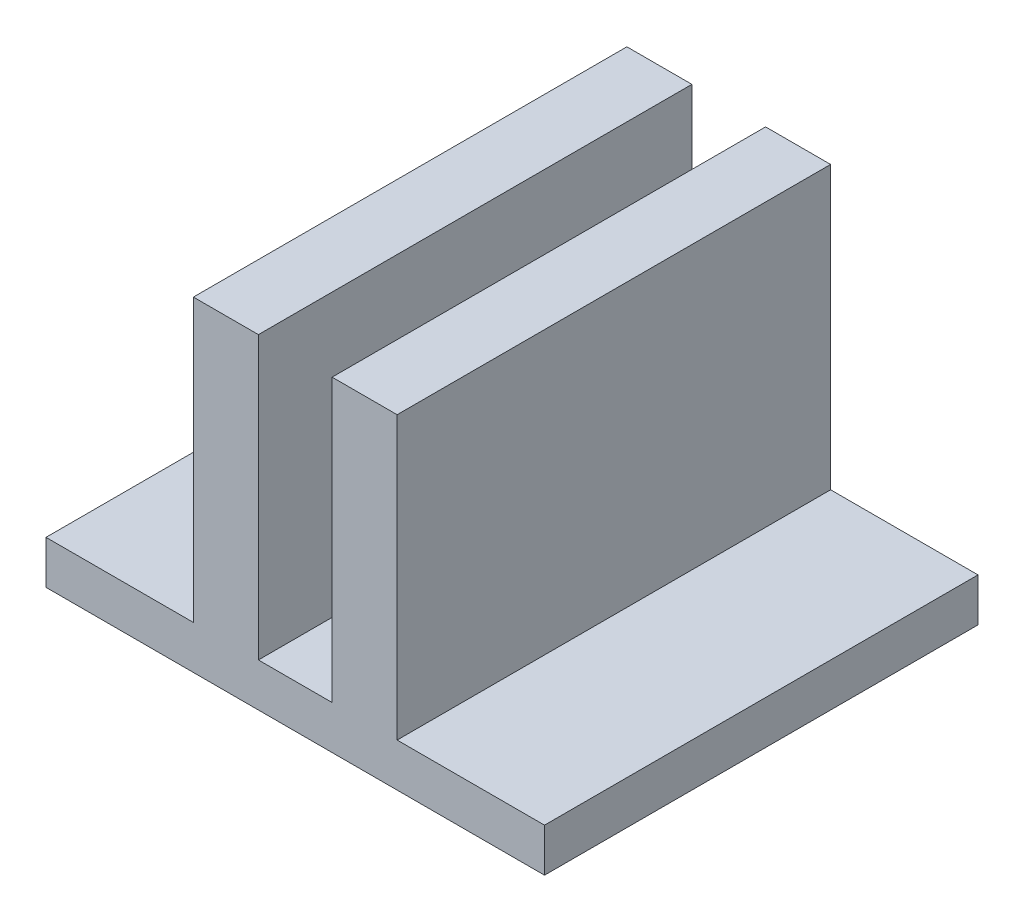
from build123d import *

# Parameters (mm, degrees)
ESQUISSE1_W             = 13
ESQUISSE1_H             = 20
BOSS_EXTRU_1_DEPTH      = 15
ESQUISSE2_W             = 2
ESQUISSE2_H             = 20
ESQUISSE2_W_2           = 3
ENL_V_MAT_EXTRU_2_DEPTH = 13
ESQUISSE4_W             = 20
ESQUISSE4_H             = 2
BOSS_EXTRU_2_DEPTH      = 5
ESQUISSE5_W             = 20
ESQUISSE5_H             = 2
BOSS_EXTRU_3_DEPTH      = 5
ESQUISSE6_W             = 20
ESQUISSE6_H             = 13
ENL_V_MAT_EXTRU_3_DEPTH = 0.2
ESQUISSE7_W             = 20
ESQUISSE7_H             = 13
ENL_V_MAT_EXTRU_4_DEPTH = 0.2
ESQUISSE8_W             = 20
ESQUISSE8_H             = 13
BOSS_EXTRU_4_DEPTH      = 0.2
ESQUISSE9_W             = 20
ESQUISSE9_H             = 13
BOSS_EXTRU_5_DEPTH      = 0.2


with BuildPart() as part:
    # Esquisse1 → Boss.-Extru.1 (new body)
    with BuildSketch(Plane(origin=(0, 0, 0), x_dir=(1, 0, 0), z_dir=(0, 1, 0))):
        with Locations((-1.892857143, 1.160714286)):
            Rectangle(ESQUISSE1_W, ESQUISSE1_H)
    extrude(amount=BOSS_EXTRU_1_DEPTH)

    # Esquisse2 → Enlèv. mat.-Extru.2 (cut)
    with BuildSketch(Plane(origin=(0, 15, 0), x_dir=(1, 0, 0), z_dir=(0, 1, 0))):
        with Locations((-7.392857143, 1.160714286)):
            Rectangle(ESQUISSE2_W, ESQUISSE2_H)
        with Locations((-1.892857143, 1.160714286)):
            Rectangle(ESQUISSE2_W_2, ESQUISSE2_H)
        with Locations((3.607142857, 1.160714286)):
            Rectangle(ESQUISSE2_W, ESQUISSE2_H)
    extrude(amount=-ENL_V_MAT_EXTRU_2_DEPTH, mode=Mode.SUBTRACT)

    # Esquisse4 → Boss.-Extru.2 (add)
    with BuildSketch(Plane.ZY.offset(8.392857143)):
        with Locations((-1.160714286, 1)):
            Rectangle(ESQUISSE4_W, ESQUISSE4_H)
    extrude(amount=BOSS_EXTRU_2_DEPTH)

    # Esquisse5 → Boss.-Extru.3 (add)
    with BuildSketch(Plane(origin=(4.607142857, 0, 0), x_dir=(0, 0, -1), z_dir=(1, 0, 0))):
        with Locations((1.160714286, 1)):
            Rectangle(ESQUISSE5_W, ESQUISSE5_H)
    extrude(amount=BOSS_EXTRU_3_DEPTH)

    # Esquisse6 → Enlèv. mat.-Extru.3 (cut)
    with BuildSketch(Plane.ZY.offset(0.392857143)):
        with Locations((-1.160714286, 8.5)):
            Rectangle(ESQUISSE6_W, ESQUISSE6_H)
    extrude(amount=-ENL_V_MAT_EXTRU_3_DEPTH, mode=Mode.SUBTRACT)

    # Esquisse7 → Enlèv. mat.-Extru.4 (cut)
    with BuildSketch(Plane(origin=(-3.392857143, 0, 0), x_dir=(0, 0, -1), z_dir=(1, 0, 0))):
        with Locations((1.160714286, 8.5)):
            Rectangle(ESQUISSE7_W, ESQUISSE7_H)
    extrude(amount=-ENL_V_MAT_EXTRU_4_DEPTH, mode=Mode.SUBTRACT)

    # Esquisse8 → Boss.-Extru.4 (add)
    with BuildSketch(Plane(origin=(2.607142857, 0, 0), x_dir=(0, 0, -1), z_dir=(1, 0, 0))):
        with Locations((1.160714286, 8.5)):
            Rectangle(ESQUISSE8_W, ESQUISSE8_H)
    extrude(amount=BOSS_EXTRU_4_DEPTH)

    # Esquisse9 → Boss.-Extru.5 (add)
    with BuildSketch(Plane.ZY.offset(6.392857143)):
        with Locations((-1.160714286, 8.5)):
            Rectangle(ESQUISSE9_W, ESQUISSE9_H)
    extrude(amount=BOSS_EXTRU_5_DEPTH)


solid = part.part
